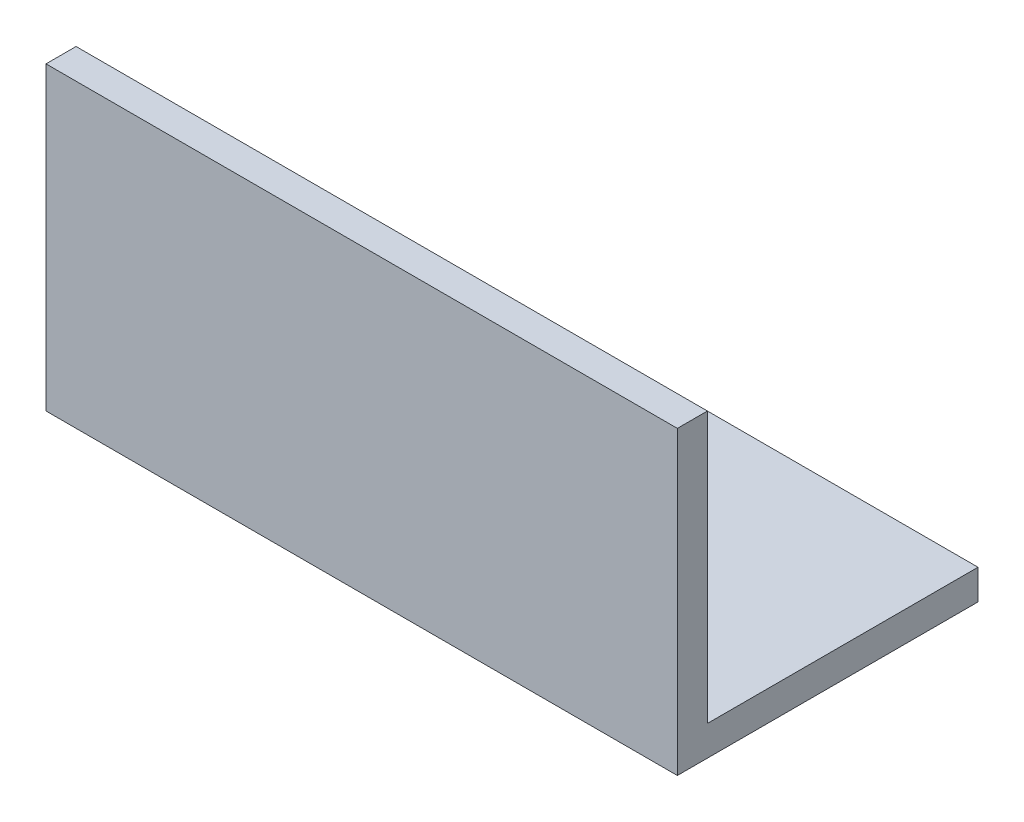
from build123d import *

# Parameters (mm, degrees)
BOSS_EXTRUDE1_DEPTH = 42
SKETCH2_R           = 1.264493958
CUT_EXTRUDE1_DEPTH  = 50.879855653


with BuildPart() as part:
    # Sketch1 → Boss-Extrude1 (new body)
    with BuildSketch(Plane(origin=(0, 0, 0), x_dir=(0, 0, -1), z_dir=(1, 0, 0))):
        Polygon((0, 20), (0, 0), (20, 0), (20, 2), (2, 2), (2, 20), align=None)
    extrude(amount=-BOSS_EXTRUDE1_DEPTH)

    # Sketch2 → Cut-Extrude1 (cut, through all)
    with BuildSketch(Plane(origin=(0, 2, 0), x_dir=(1, 0, 0), z_dir=(0, 1, 0))):
        with Locations(Location((-21, 15.261871586, 0), (0, 0, 270))):
            Circle(SKETCH2_R)
        with Locations(Location((-16.738128414, 11, 0), (0, 0, 270))):
            Circle(SKETCH2_R)
        with Locations(Location((-21, 6.738128414, 0), (0, 0, 270))):
            Circle(SKETCH2_R)
        with Locations(Location((-25.261871586, 11, 0), (0, 0, 270))):
            Circle(SKETCH2_R)
    extrude(amount=-CUT_EXTRUDE1_DEPTH, mode=Mode.SUBTRACT)


solid = part.part
